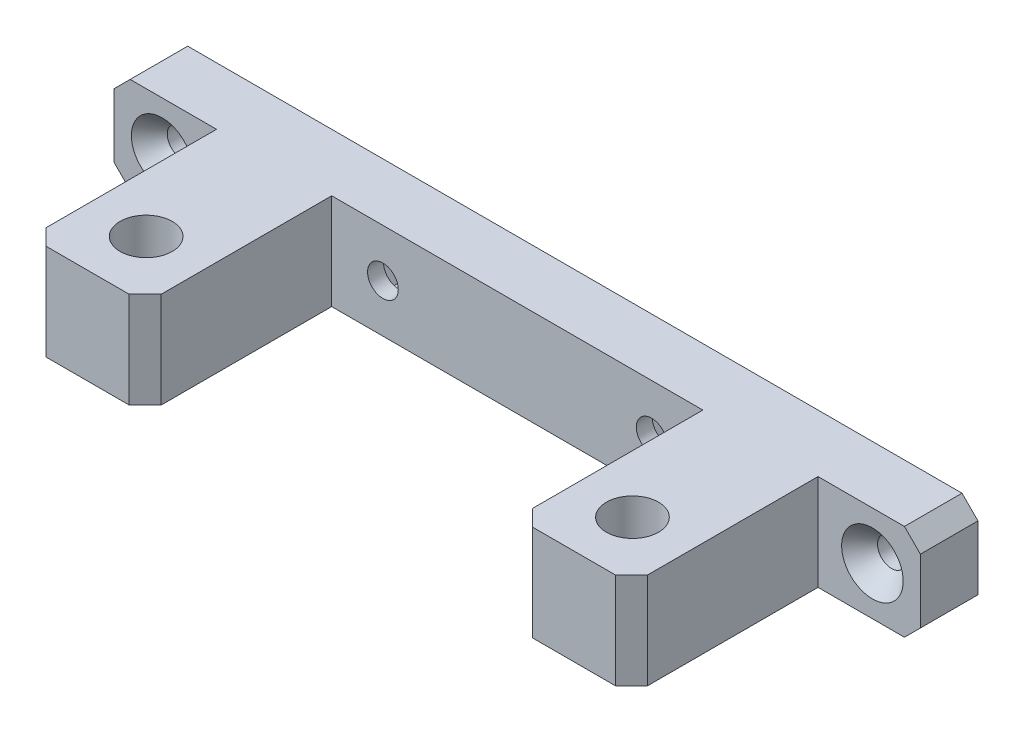
from build123d import *

# Parameters (mm, degrees)
SKETCH1_W               = 126
SKETCH1_H               = 15
SKETCH1_R               = 2.4
SKETCH1_R_2             = 2.2
BOSS_EXTRUDE1_DEPTH     = 9
SKETCH2_W               = 18
SKETCH2_H               = 15
BOSS_EXTRUDE2_DEPTH     = 29.15
CUT_EXTRUDE1_DEPTH      = 133.500650942
CUT_EXTRUDE1_DEPTH_BACK = 133.500650942
SKETCH4_R               = 4.075
CUT_EXTRUDE2_DEPTH      = 6.5
CHAMFER1_SIZE           = 2.5


with BuildPart() as part:
    # Sketch1 → Boss-Extrude1 (new body)
    with BuildSketch(Plane.XY):
        with Locations((63, -7.5)):
            Rectangle(SKETCH1_W, SKETCH1_H)
        with Locations((42, -7.5)):
            Circle(SKETCH1_R, mode=Mode.SUBTRACT)
        with Locations((7.5, -7.5)):
            Circle(SKETCH1_R_2, mode=Mode.SUBTRACT)
        with Locations(Location((118.5, -7.5, 0), (0, 0, 180))):
            Circle(SKETCH1_R_2, mode=Mode.SUBTRACT)
        with Locations(Location((84, -7.5, 0), (0, 0, 180))):
            Circle(SKETCH1_R, mode=Mode.SUBTRACT)
    extrude(amount=BOSS_EXTRUDE1_DEPTH)

    # Sketch2 → Boss-Extrude2 (add)
    with BuildSketch(Plane.XY.offset(9)):
        with Locations((101, -7.5)):
            Rectangle(SKETCH2_W, SKETCH2_H)
        with Locations((25, -7.5)):
            Rectangle(SKETCH2_W, SKETCH2_H)
    extrude(amount=BOSS_EXTRUDE2_DEPTH)

    # Sketch4 → Cut-Extrude1 (cut, two sides: drawn at the far end of the back side and taken through both)
    with BuildSketch(Plane.XZ.offset(15).offset(-CUT_EXTRUDE1_DEPTH_BACK)):
        with Locations(Location((25, 29, 0), (0, 0, 270))):
            Circle(SKETCH4_R)
        with Locations(Location((101, 29, 0), (0, 0, 90))):
            Circle(SKETCH4_R)
    extrude(amount=CUT_EXTRUDE1_DEPTH + CUT_EXTRUDE1_DEPTH_BACK, mode=Mode.SUBTRACT)

    # Sketch5 → Cut-Extrude2 (cut)
    with BuildSketch(Plane(origin=(0, 0, 0), x_dir=(-1, 0, 0), z_dir=(0, 0, -1))):
        Polygon((-81.892671517, -11.15), (-79.785343035, -7.5), (-81.892671517, -3.85), (-86.107328483, -3.85), (-88.214656965, -7.5), (-86.107328483, -11.15), align=None)
        Polygon((-39.892671517, -11.15), (-44.107328483, -11.15), (-46.214656965, -7.5), (-44.107328483, -3.85), (-39.892671517, -3.85), (-37.785343035, -7.5), align=None)
    extrude(amount=-CUT_EXTRUDE2_DEPTH, mode=Mode.SUBTRACT)

    # Sketch7 → Cut-Revolve1 (revolve, cut)
    with BuildSketch(Plane(origin=(118.5, 0, 0), x_dir=(0, 0, -1), z_dir=(1, 0, 0)), mode=Mode.PRIVATE) as cut_revolve1_sk:
        Polygon((-9, -7.5), (-6, -7.5), (-6, -5.3), (-9, -2.692139787), align=None)
    cut_revolve1 = revolve(cut_revolve1_sk.sketch.rotate(Axis((118.5, -7.5, 9), (0, 0, -1)), 270), axis=Axis((118.5, -7.5, 9), (0, 0, -1)), mode=Mode.SUBTRACT)

    # Mirror1: Cut-Revolve1 across plane
    add(cut_revolve1.mirror(Plane(origin=(63, 0, 0), x_dir=(0, 0, 1), z_dir=(1, 0, 0))), mode=Mode.SUBTRACT)

    # Chamfer1
    chamfer1_edges = [part.edges().sort_by_distance(p)[0] for p in [
        (34, -7.5, 38.15),
        (16, -7.5, 38.15),
        (110, -7.5, 38.15),
        (92, -7.5, 38.15),
        (0, 0, 4.5),
        (126, 0, 4.5),
        (126, -15, 4.5),
        (0, -15, 4.5),
    ]]
    chamfer(chamfer1_edges, length=CHAMFER1_SIZE)


solid = part.part
